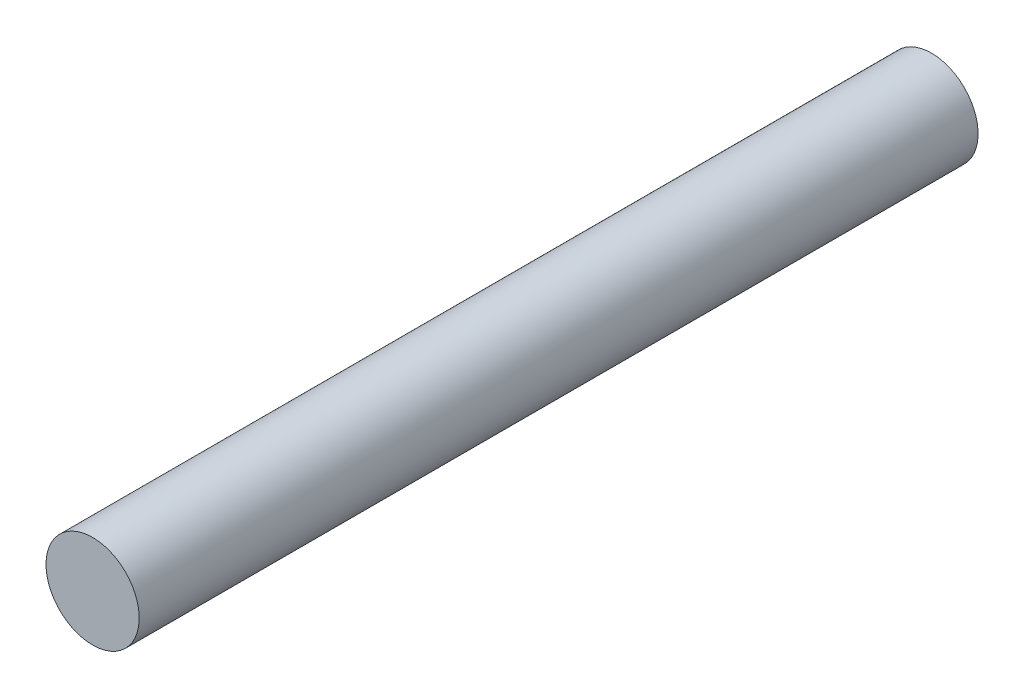
from build123d import *

# Parameters (mm, degrees)
SKETCH1_R           = 5
BOSS_EXTRUDE1_DEPTH = 90


with BuildPart() as part:
    # Sketch1 → Boss-Extrude1 (new body)
    with BuildSketch(Plane.XY):
        with Locations(Location((0, 0, 0), (0, 0, 180))):
            Circle(SKETCH1_R)
    extrude(amount=BOSS_EXTRUDE1_DEPTH)


solid = part.part
